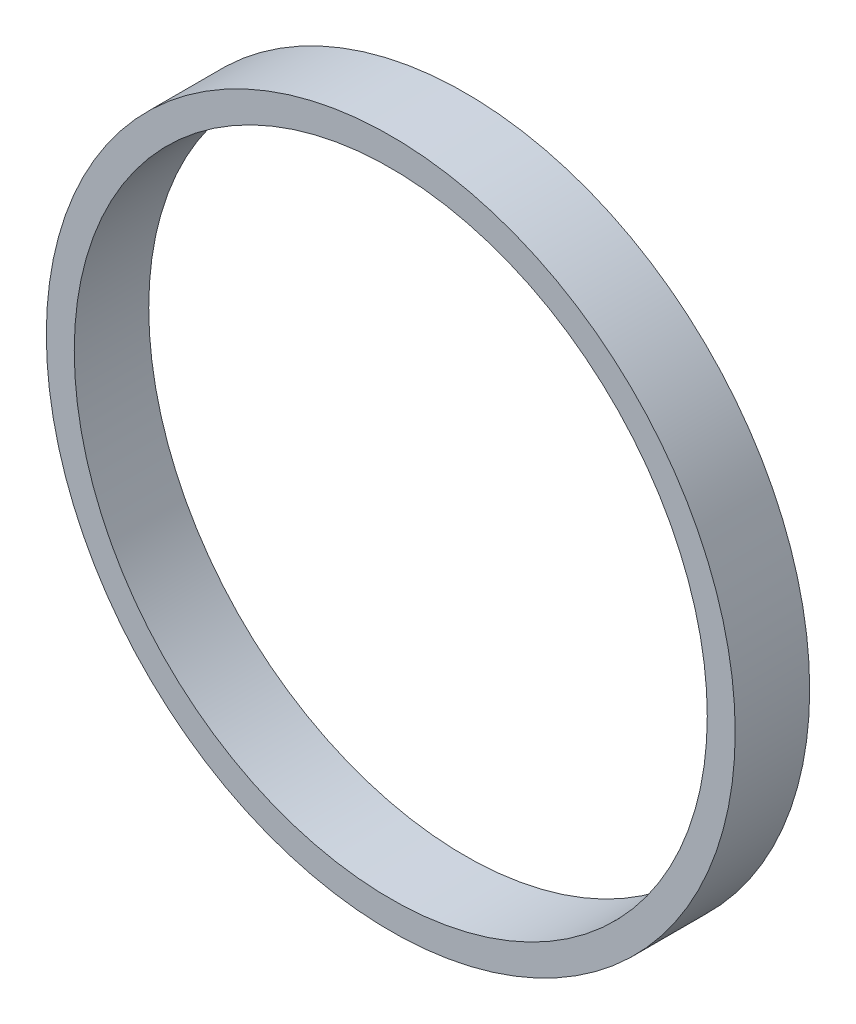
from build123d import *

# Parameters (mm, degrees)
SKETCH1_R           = 18.5
SKETCH1_R_2         = 17
BOSS_EXTRUDE1_DEPTH = 4


with BuildPart() as part:
    # Sketch1 → Boss-Extrude1 (new body)
    with BuildSketch(Plane.XY):
        Circle(SKETCH1_R)
        Circle(SKETCH1_R_2, mode=Mode.SUBTRACT)
    extrude(amount=BOSS_EXTRUDE1_DEPTH)


solid = part.part
